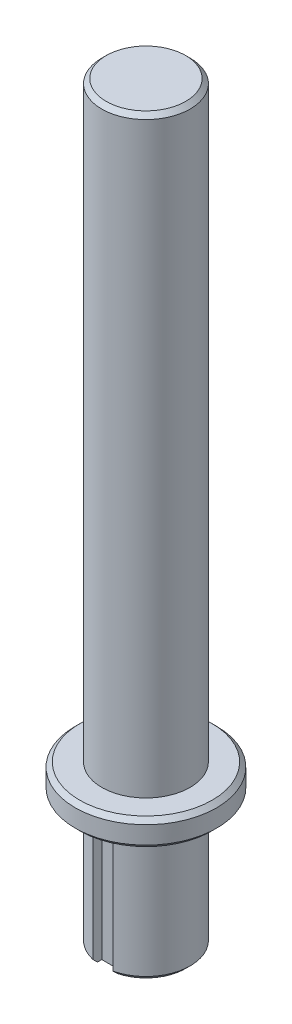
from build123d import *

# Parameters (mm, degrees)
SKETCH2_W          = 2.25
SKETCH2_H          = 2.25
CUT_EXTRUDE1_DEPTH = 15
CHAMFER1_SIZE      = 0.5
CHAMFER2_SIZE      = 0.5


with BuildPart() as part:
    # Sketch1 → Revolve1 (revolve)
    with BuildSketch(Plane.XY, mode=Mode.PRIVATE) as revolve1_sk:
        Polygon((0, 0), (5, 0), (5, 15), (8, 15), (8, 18), (5, 18), (5, 85), (0, 85), align=None)
    revolve(revolve1_sk.sketch.rotate(Axis((0, 85, 0), (0, -1, 0)), 180), axis=Axis((0, 85, 0), (0, -1, 0)))

    # Sketch2 → Cut-Extrude1 (cut)
    with BuildSketch(Plane.XZ):
        with Locations((0, 5)):
            Rectangle(SKETCH2_W, SKETCH2_H)
    extrude(amount=-CUT_EXTRUDE1_DEPTH, mode=Mode.SUBTRACT)

    # Chamfer1
    chamfer1_edges = [part.edges().sort_by_distance(p)[0] for p in [
        (8, 18, 0),
        (8, 15, 0),
    ]]
    chamfer(chamfer1_edges, length=CHAMFER1_SIZE)

    # Chamfer2
    chamfer2_edges = [part.edges().sort_by_distance(p)[0] for p in [
        (0, 0, -5),
        (5, 85, 0),
    ]]
    chamfer(chamfer2_edges, length=CHAMFER2_SIZE)


solid = part.part
